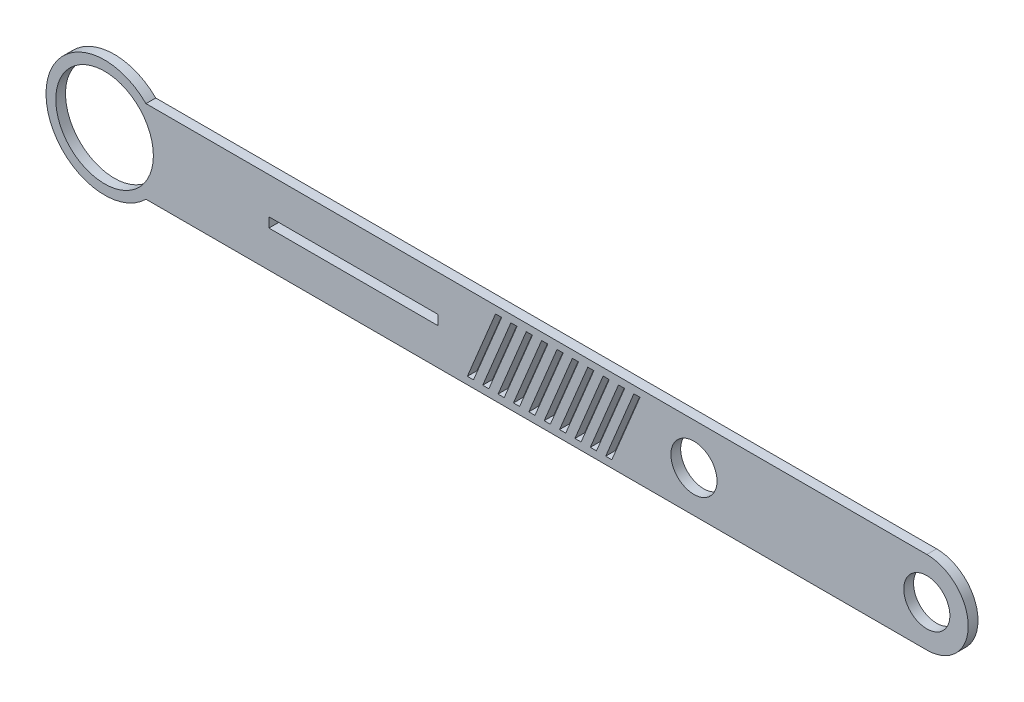
from build123d import *

# Parameters (mm, degrees)
SKETCH1_R           = 15.875
SKETCH1_R_2         = 7.5
SKETCH1_W           = 55
SKETCH1_H           = 3.175
BOSS_EXTRUDE1_DEPTH = 3.175


with BuildPart() as part:
    # Sketch1 → Boss-Extrude1 (new body)
    with BuildSketch(Plane.XY):
        with BuildLine():
            Line((13.470384182, 13.470384182), (267.470384182, 13.470384182))
            ThreePointArc((267.470384182, 13.470384182), (280.940768363, 0), (267.470384182, -13.470384182))
            Line((267.470384182, -13.470384182), (13.470384182, -13.470384182))
            ThreePointArc((13.470384182, -13.470384182), (-19.05, 0), (13.470384182, 13.470384182))
        make_face()
        Circle(SKETCH1_R, mode=Mode.SUBTRACT)
        with Locations((267.470384182, 0)):
            Circle(SKETCH1_R_2, mode=Mode.SUBTRACT)
        with Locations((191.720384182, 0)):
            Circle(SKETCH1_R_2, mode=Mode.SUBTRACT)
        Polygon((122.588897068, 0), (118.001577828, -11.0885753), (120.001577828, -11.0885753), (129.176216309, 11.0885753), (127.176216309, 11.0885753), align=None, mode=Mode.SUBTRACT)
        with Locations((80.970384182, 0)):
            Rectangle(SKETCH1_W, SKETCH1_H, mode=Mode.SUBTRACT)
        Polygon((134.176216309, 11.0885753), (125.001577828, -11.0885753), (123.001577828, -11.0885753), (127.588897068, 0), (132.176216309, 11.0885753), align=None, mode=Mode.SUBTRACT)
        Polygon((139.176216309, 11.0885753), (130.001577828, -11.0885753), (128.001577828, -11.0885753), (132.588897068, 0), (137.176216309, 11.0885753), align=None, mode=Mode.SUBTRACT)
        Polygon((144.176216309, 11.0885753), (135.001577828, -11.0885753), (133.001577828, -11.0885753), (137.588897068, 0), (142.176216309, 11.0885753), align=None, mode=Mode.SUBTRACT)
        Polygon((149.176216309, 11.0885753), (140.001577828, -11.0885753), (138.001577828, -11.0885753), (142.588897068, 0), (147.176216309, 11.0885753), align=None, mode=Mode.SUBTRACT)
        Polygon((154.176216309, 11.0885753), (145.001577828, -11.0885753), (143.001577828, -11.0885753), (147.588897068, 0), (152.176216309, 11.0885753), align=None, mode=Mode.SUBTRACT)
        Polygon((159.176216309, 11.0885753), (150.001577828, -11.0885753), (148.001577828, -11.0885753), (152.588897068, 0), (157.176216309, 11.0885753), align=None, mode=Mode.SUBTRACT)
        Polygon((164.176216309, 11.0885753), (155.001577828, -11.0885753), (153.001577828, -11.0885753), (157.588897068, 0), (162.176216309, 11.0885753), align=None, mode=Mode.SUBTRACT)
        Polygon((169.176216309, 11.0885753), (160.001577828, -11.0885753), (158.001577828, -11.0885753), (162.588897068, 0), (167.176216309, 11.0885753), align=None, mode=Mode.SUBTRACT)
        Polygon((174.176216309, 11.0885753), (165.001577828, -11.0885753), (163.001577828, -11.0885753), (167.588897068, 0), (172.176216309, 11.0885753), align=None, mode=Mode.SUBTRACT)
    extrude(amount=BOSS_EXTRUDE1_DEPTH)


solid = part.part
